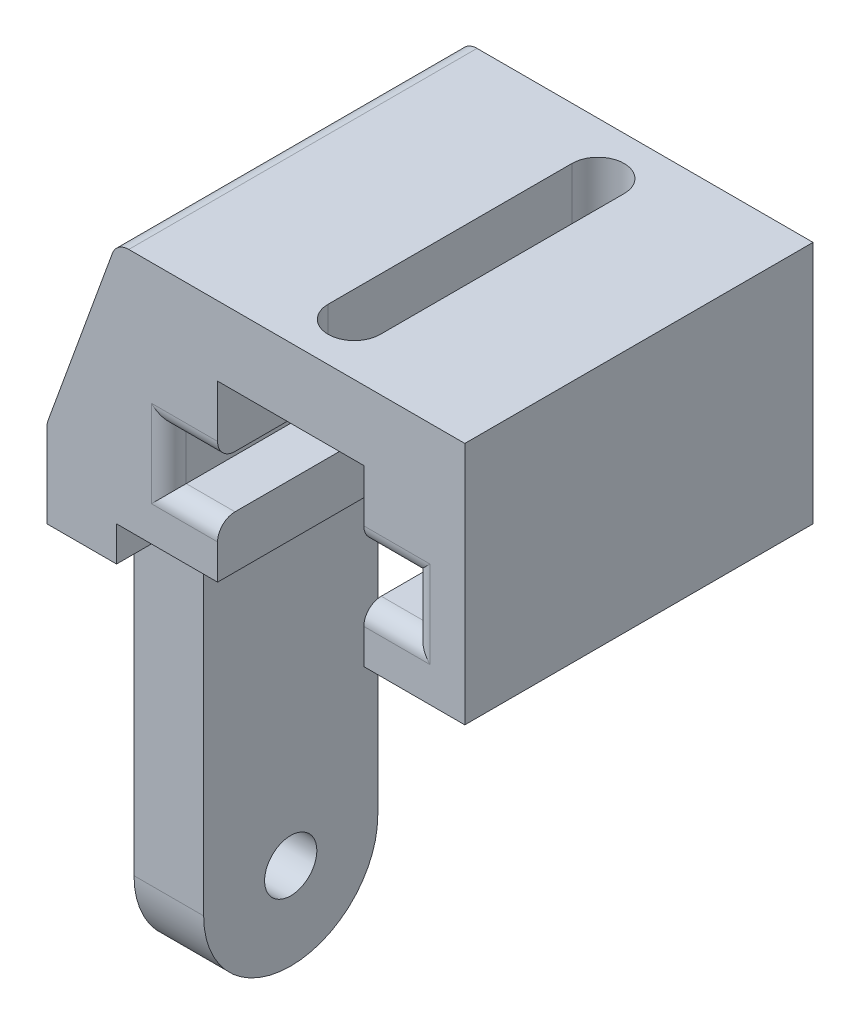
from build123d import *

# Parameters (mm, degrees)
EXTRUDE_1_DEPTH     = 20
SKETCH_2_R          = 1.5
EXTRUDE_2_DEPTH     = 4
FILLET_6_R          = 1
CUT_EXTRUDE_1_REACH = 51.81


with BuildPart() as part:
    # 草图1 → 凸台-拉伸1 (new body)
    with BuildSketch(Plane.XY):
        Polygon((5.8, 6), (3, 6), (3, 3), (5.8, 3), (5.8, 0), (0, 0), (0, -2), (-4, -2), (-4, 3), (0, 14), (20, 14), (20, 0), (14.2, 0), (14.2, 3), (17, 3), (17, 6), (14.2, 6), (14.2, 10), (5.8, 10), align=None)
    extrude(amount=EXTRUDE_1_DEPTH)

    # 草图2 → 凸台-拉伸2 (add)
    with BuildSketch(Plane.ZY.offset(4)):
        with BuildLine():
            Line((5, -2), (15, -2))
            Line((15, -2), (15, -22))
            ThreePointArc((15, -22), (10, -27), (5, -22))
            Line((5, -22), (5, -2))
        make_face()
        with Locations(Location((10, -22, 0), (0, 0, 270))):
            Circle(SKETCH_2_R, mode=Mode.SUBTRACT)
    extrude(amount=-EXTRUDE_2_DEPTH)

    # 圆角6
    fillet_6_edges = [part.edges().sort_by_distance(p)[0] for p in [
        (4.4, 3, 20),
        (3, 4.5, 20),
        (15.6, 3, 0),
        (17, 4.5, 0),
        (15.6, 6, 0),
        (4.4, 6, 0),
        (3, 4.5, 0),
        (4.4, 3, 0),
        (4.4, 6, 20),
        (-4, 3, 10),
        (0, 14, 10),
        (15.6, 6, 20),
        (17, 4.5, 20),
        (15.6, 3, 20),
    ]]
    fillet(fillet_6_edges, radius=FILLET_6_R)

    # 草图3 → 切除-拉伸1 (cut, up to next)
    with BuildSketch(Plane(origin=(0, 14, 0), x_dir=(1, 0, 0), z_dir=(0, 1, 0)), mode=Mode.PRIVATE) as cut_extrude_1_sk1:
        with BuildLine():
            Line((9.150213632, -3), (9.150213632, -17))
            ThreePointArc((9.150213632, -17), (10.650213632, -18.5), (12.150213632, -17))
            Line((12.150213632, -17), (12.150213632, -3))
            ThreePointArc((12.150213632, -3), (10.650213632, -1.5), (9.150213632, -3))
        make_face()
    cut_extrude_1_tool1 = extrude(cut_extrude_1_sk1.sketch, amount=-CUT_EXTRUDE_1_REACH, mode=Mode.PRIVATE) & part.part
    add(cut_extrude_1_tool1.solids().sort_by_distance((10.650214, 14, 10))[0], mode=Mode.SUBTRACT)


solid = part.part
